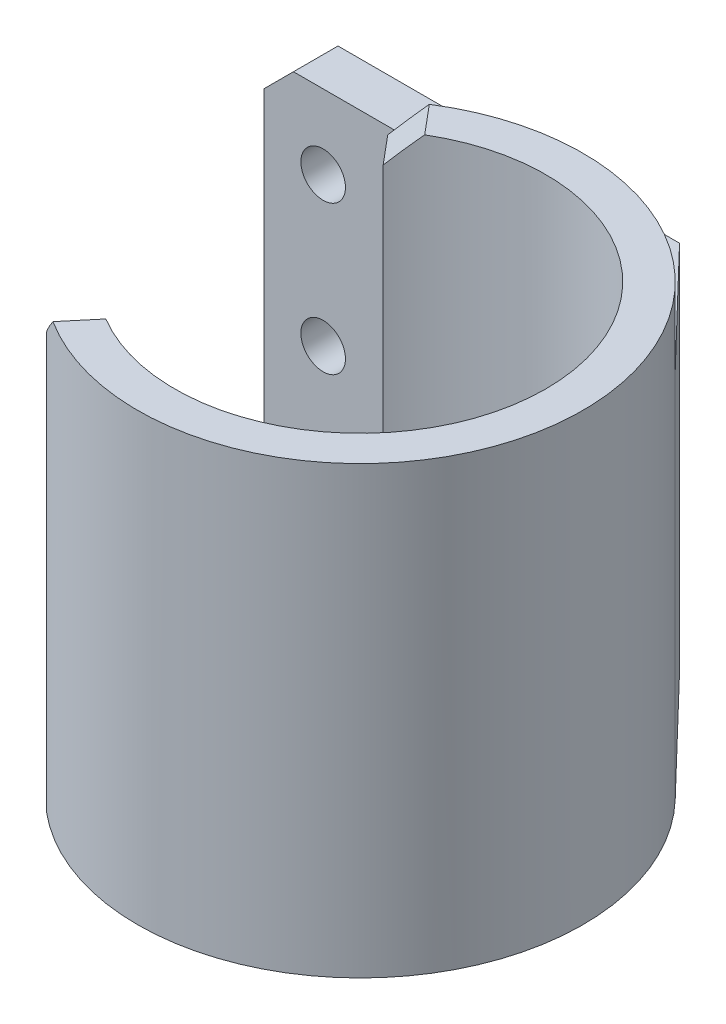
from build123d import *

# Parameters (mm, degrees)
SKETCH1_R           = 15
SKETCH1_R_2         = 6.25
BOSS_EXTRUDE1_DEPTH = 10
SKETCH2_R           = 15
SKETCH2_R_2         = 12.5
BOSS_EXTRUDE2_DEPTH = 20
CUT_EXTRUDE1_DEPTH  = 37.742346142
BOSS_EXTRUDE3_DEPTH = 25
SKETCH5_R           = 1.5
CUT_EXTRUDE2_DEPTH  = 48.563115962
CUT_EXTRUDE3_DEPTH  = 35.441980199
CHAMFER2_SIZE       = 2


with BuildPart() as part:
    # Sketch1 → Boss-Extrude1 (new body)
    with BuildSketch(Plane(origin=(0, 0, 0), x_dir=(1, 0, 0), z_dir=(0, 1, 0))):
        with Locations(Location((0, 0, 0), (0, 0, 270))):
            Circle(SKETCH1_R)
        with Locations(Location((0, 0, 0), (0, 0, 270))):
            Circle(SKETCH1_R_2, mode=Mode.SUBTRACT)
    extrude(amount=BOSS_EXTRUDE1_DEPTH)

    # Sketch2 → Boss-Extrude2 (add)
    with BuildSketch(Plane(origin=(0, 10, 0), x_dir=(1, 0, 0), z_dir=(0, 1, 0))):
        with Locations(Location((0, 0, 0), (0, 0, 270))):
            Circle(SKETCH2_R)
        with Locations(Location((0, 0, 0), (0, 0, 270))):
            Circle(SKETCH2_R_2, mode=Mode.SUBTRACT)
    extrude(amount=BOSS_EXTRUDE2_DEPTH)

    # Sketch3 → Cut-Extrude1 (cut, through all)
    with BuildSketch(Plane(origin=(0, 0, 0), x_dir=(1, 0, 0), z_dir=(0, 1, 0))):
        with BuildLine():
            Line((0, 0), (-9.641814145, 11.490666647))
            ThreePointArc((-9.641814145, 11.490666647), (-15, 0), (-9.641814145, -11.490666647))
            Line((-9.641814145, -11.490666647), (0, 0))
        make_face()
    extrude(amount=CUT_EXTRUDE1_DEPTH, mode=Mode.SUBTRACT)

    # Sketch4 → Boss-Extrude3 (add)
    with BuildSketch(Plane(origin=(0, 0, 0), x_dir=(1, 0, 0), z_dir=(0, 1, 0))):
        with BuildLine():
            Line((-9.641814145, 11.490666647), (-9.641814145, 15))
            Line((-9.641814145, 15), (-21.5, 15))
            Line((-21.5, 15), (-21.5, 18))
            Line((-21.5, 18), (3.5, 18))
            Line((3.5, 18), (10.811384743, 10.3977863))
            ThreePointArc((10.811384743, 10.3977863), (0.800356614, 14.978632424), (-9.641814145, 11.490666647))
        make_face()
    extrude(amount=BOSS_EXTRUDE3_DEPTH)

    # Sketch5 → Cut-Extrude2 (cut, through all)
    with BuildSketch(Plane.XY.offset(-15)):
        with Locations((-17.5, 20)):
            Circle(SKETCH5_R)
        with Locations((-17.5, 10)):
            Circle(SKETCH5_R)
    extrude(amount=-CUT_EXTRUDE2_DEPTH, mode=Mode.SUBTRACT)

    # Sketch6 → Cut-Extrude3 (cut, through all)
    with BuildSketch(Plane(origin=(0, 10, 0), x_dir=(1, 0, 0), z_dir=(0, 1, 0))):
        with BuildLine():
            Line((0, -6.25), (-12.5, -6.25))
            ThreePointArc((-12.5, -6.25), (-18.75, 0), (-12.5, 6.25))
            Line((-12.5, 6.25), (0, 6.25))
            ThreePointArc((0, 6.25), (6.25, 0), (0, -6.25))
        make_face()
    extrude(amount=-CUT_EXTRUDE3_DEPTH, mode=Mode.SUBTRACT)

    # Chamfer2
    chamfer2_edges = [part.edges().sort_by_distance(p)[0] for p in [
        (-8.838329633, 30, -10.533111093),
        (-8.838329633, 30, 10.533111093),
        (-21.5, 25, -16.5),
    ]]
    chamfer(chamfer2_edges, length=CHAMFER2_SIZE)


solid = part.part
